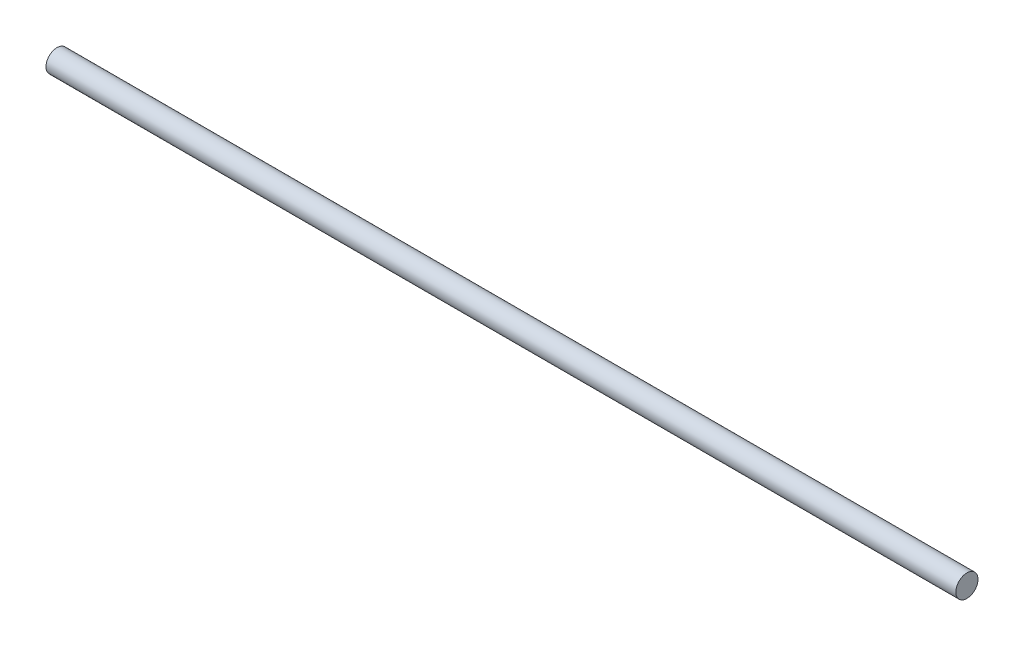
from build123d import *

# Parameters (mm, degrees)
SKETCH2_R           = 0.975
BOSS_EXTRUDE1_DEPTH = 80


with BuildPart() as part:
    # Sketch2 → Boss-Extrude1 (new body)
    with BuildSketch(Plane(origin=(0, 0, 0), x_dir=(0, 0, -1), z_dir=(1, 0, 0))):
        Circle(SKETCH2_R)
    extrude(amount=BOSS_EXTRUDE1_DEPTH)


solid = part.part
